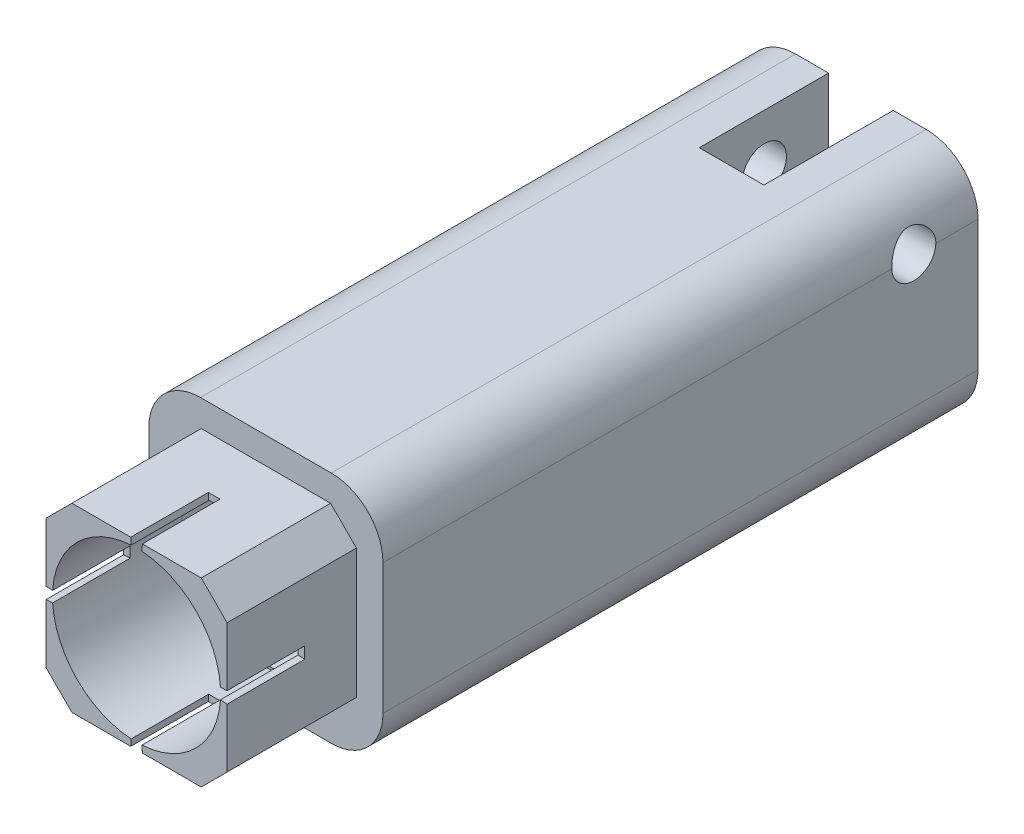
from build123d import *

# Parameters (mm, degrees)
BOSS_EXTRUDE1_DEPTH = 46
SKETCH3_R           = 6.5
BOSS_EXTRUDE2_DEPTH = 10
CUT_EXTRUDE7_DEPTH  = 6
CIRPATTERN1_COUNT   = 4
SKETCH12_R          = 6.5
CUT_EXTRUDE8_DEPTH  = 30
CUT_EXTRUDE9_DEPTH  = 10
SKETCH14_R          = 1.705
CUT_EXTRUDE10_DEPTH = 12.5


with BuildPart() as part:
    # Sketch1 → Boss-Extrude1 (new body)
    with BuildSketch(Plane.XY):
        with BuildLine():
            Line((-5.05, 9.05), (5.05, 9.05))
            ThreePointArc((5.05, 9.05), (7.878427125, 7.878427125), (9.05, 5.05))
            Line((9.05, 5.05), (9.05, -5.05))
            ThreePointArc((9.05, -5.05), (7.878427125, -7.878427125), (5.05, -9.05))
            Line((5.05, -9.05), (-5.05, -9.05))
            ThreePointArc((-5.05, -9.05), (-7.878427125, -7.878427125), (-9.05, -5.05))
            Line((-9.05, -5.05), (-9.05, 5.05))
            ThreePointArc((-9.05, 5.05), (-7.878427125, 7.878427125), (-5.05, 9.05))
        make_face()
    extrude(amount=BOSS_EXTRUDE1_DEPTH)

    # Sketch3 → Boss-Extrude2 (add)
    with BuildSketch(Plane.XY.offset(46)):
        Polygon((-5, -7), (5, -7), (7, -5), (7, 5), (5, 7), (-5, 7), (-7, 5), (-7, -5), align=None)
        Circle(SKETCH3_R, mode=Mode.SUBTRACT)
    extrude(amount=BOSS_EXTRUDE2_DEPTH)

    # Sketch11 → Cut-Extrude7 (cut)
    with BuildSketch(Plane.XY.offset(56)):
        Polygon((0, 0), (7, 0.45), (7, -0.45), align=None)
    cut_extrude7 = extrude(amount=-CUT_EXTRUDE7_DEPTH, mode=Mode.SUBTRACT)

    # CirPattern1: Cut-Extrude7 ×4 about axis
    cirpattern1_axis = Axis((0, 0, 56), (0, 0, -1))
    for i in range(1, CIRPATTERN1_COUNT):
        add(cut_extrude7.rotate(cirpattern1_axis, i * 360 / CIRPATTERN1_COUNT), mode=Mode.SUBTRACT)

    # Sketch12 → Cut-Extrude8 (cut)
    with BuildSketch(Plane.XY.offset(46)):
        with Locations((0, 0.192488852)):
            Circle(SKETCH12_R)
    extrude(amount=-CUT_EXTRUDE8_DEPTH, mode=Mode.SUBTRACT)

    # Sketch13 → Cut-Extrude9 (cut)
    with BuildSketch(Plane.XY):
        with BuildLine():
            Line((-2.5, 0), (-2.5, 9.05))
            Line((-2.5, 9.05), (2.5, 9.05))
            Line((2.5, 9.05), (2.5, 0))
            ThreePointArc((2.5, 0), (0, -2.5), (-2.5, 0))
        make_face()
    extrude(amount=CUT_EXTRUDE9_DEPTH, mode=Mode.SUBTRACT)

    # Sketch14 → Cut-Extrude10 (cut, symmetric)
    with BuildSketch(Plane(origin=(0, 0, 0), x_dir=(0, 0, -1), z_dir=(1, 0, 0))):
        with Locations((-4.963568093, 5.105)):
            Circle(SKETCH14_R)
    extrude(amount=CUT_EXTRUDE10_DEPTH, both=True, mode=Mode.SUBTRACT)


solid = part.part
